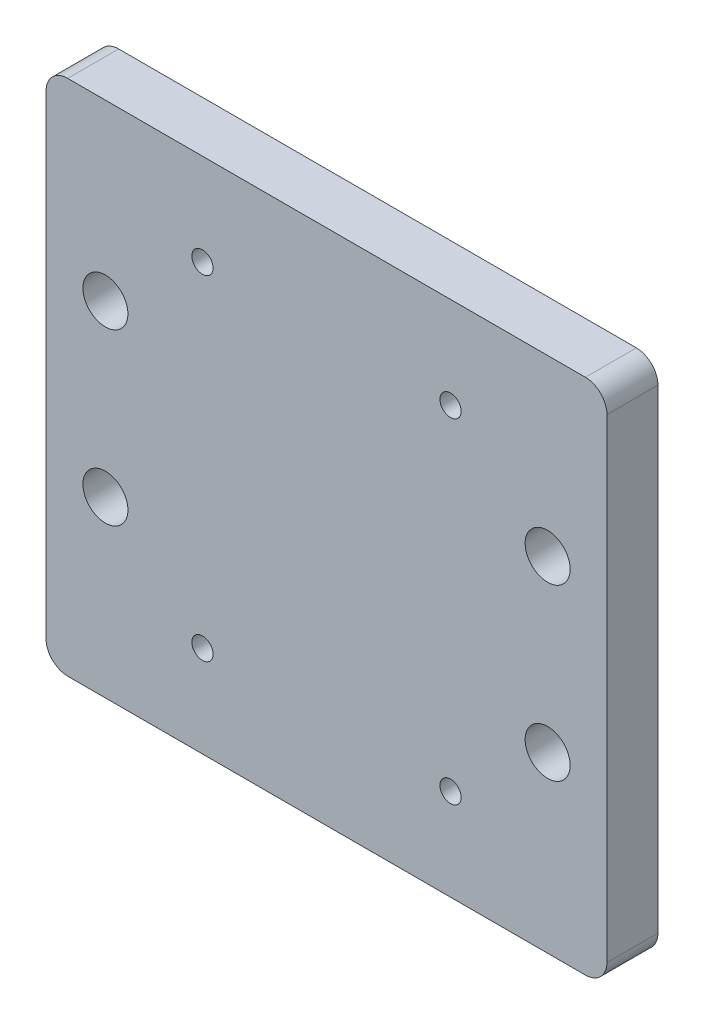
from build123d import *

# Parameters (mm, degrees)
BOSS_EXTRUDE1_DEPTH   = 6
M5_CLEARANCE_HOLE1_D  = 5.3
M3X0_5_TAPPED_HOLE1_D = 2.5


with BuildPart() as part:
    # Sketch1 → Boss-Extrude1 (new body)
    with BuildSketch(Plane(origin=(0, 0, -11.999999876), x_dir=(-1, 0, 0), z_dir=(0, 0, -1))):
        with BuildLine():
            Line((-526.0721, 434.1114), (-465.1121, 434.1114))
            ThreePointArc((-465.1121, 434.1114), (-463.316048776, 433.367451224), (-462.5721, 431.5714))
            Line((-462.5721, 431.5714), (-462.5721, 375.6914))
            ThreePointArc((-462.5721, 375.6914), (-463.316048776, 373.895348776), (-465.1121, 373.1514))
            Line((-465.1121, 373.1514), (-526.0721, 373.1514))
            ThreePointArc((-526.0721, 373.1514), (-527.868151224, 373.895348776), (-528.6121, 375.6914))
            Line((-528.6121, 375.6914), (-528.6121, 431.5714))
            ThreePointArc((-528.6121, 431.5714), (-527.868151224, 433.367451224), (-526.0721, 434.1114))
        make_face()
    extrude(amount=BOSS_EXTRUDE1_DEPTH)

    # M5 Clearance Hole1 (through all)
    with Locations(Plane(origin=(0, 0, -17.999999876), x_dir=(-1, 0, 0), z_dir=(0, 0, -1))):
        with Locations((-521.6271, 413.631399939), (-521.6271, 393.631400061), (-469.5571, 393.631400061), (-469.5571, 413.631399939)):
            Hole(M5_CLEARANCE_HOLE1_D / 2)

    # M3x0.5 Tapped Hole1 (through all)
    with Locations(Plane(origin=(0, 0, -17.999999876), x_dir=(-1, 0, 0), z_dir=(0, 0, -1))):
        with Locations((-510.1971, 423.3164), (-480.9871, 423.3164), (-480.9871, 383.9464), (-510.1971, 383.9464)):
            Hole(M3X0_5_TAPPED_HOLE1_D / 2)


solid = part.part
